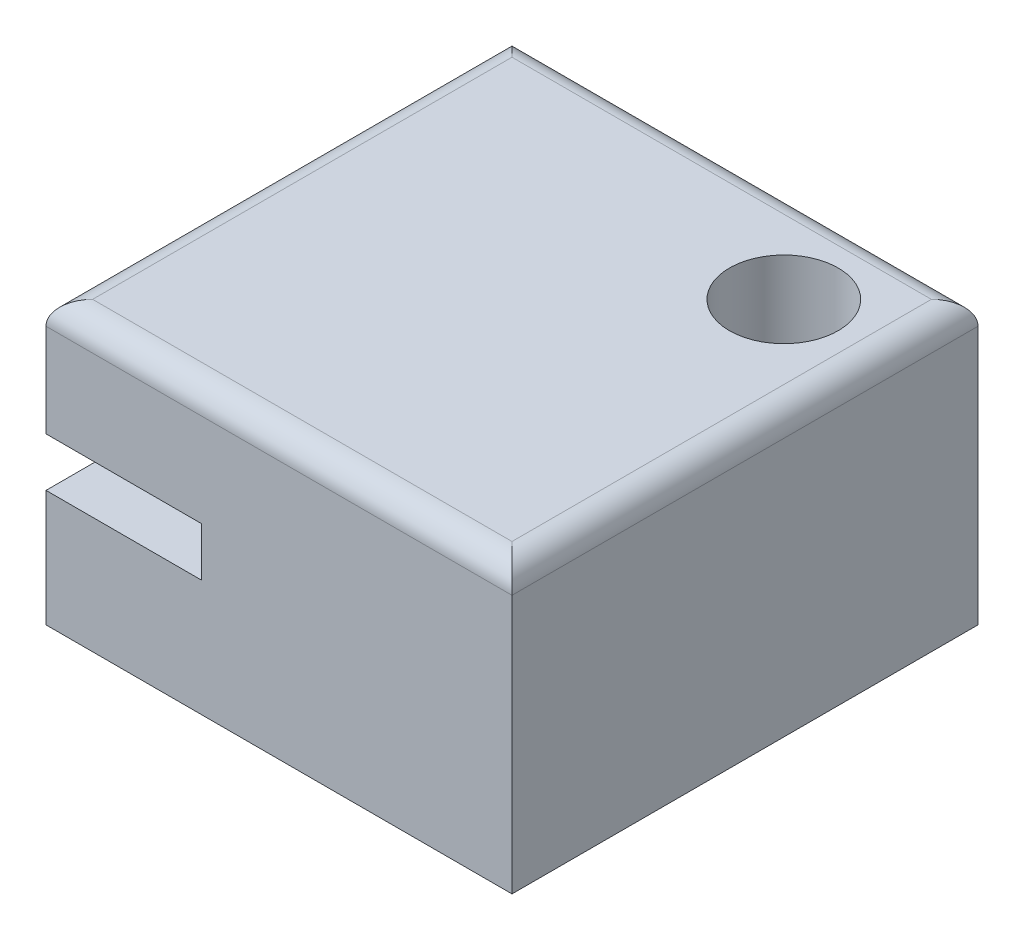
from build123d import *

# Parameters (mm, degrees)
SKETCH1_W           = 15.24
SKETCH1_H           = 15.24
BOSS_EXTRUDE1_DEPTH = 3.81
BOSS_EXTRUDE2_DEPTH = 1.6002
SKETCH3_W           = 15.24
SKETCH3_H           = 15.24
BOSS_EXTRUDE3_DEPTH = 3.81
SKETCH4_R           = 1.778
CUT_EXTRUDE1_DEPTH  = 15.851000211
FILLET1_R           = 0.762


with BuildPart() as part:
    # Sketch1 → Boss-Extrude1 (new body)
    with BuildSketch(Plane(origin=(0, 0, 0), x_dir=(1, 0, 0), z_dir=(0, 1, 0))):
        with Locations((-1.182029268, 0)):
            Rectangle(SKETCH1_W, SKETCH1_H)
    extrude(amount=BOSS_EXTRUDE1_DEPTH)

    # Sketch2 → Boss-Extrude2 (add)
    with BuildSketch(Plane(origin=(0, 3.81, 0), x_dir=(1, 0, 0), z_dir=(0, 1, 0))):
        Polygon((-8.802029268, -2.54), (-3.722029268, -2.54), (-3.722029268, -7.62), (6.437970732, -7.62), (6.437970732, 7.62), (-8.802029268, 7.62), align=None)
    extrude(amount=BOSS_EXTRUDE2_DEPTH)

    # Sketch3 → Boss-Extrude3 (add)
    with BuildSketch(Plane(origin=(0, 5.4102, 0), x_dir=(1, 0, 0), z_dir=(0, 1, 0))):
        with Locations((-1.182029268, 0)):
            Rectangle(SKETCH3_W, SKETCH3_H)
    extrude(amount=BOSS_EXTRUDE3_DEPTH)

    # Sketch4 → Cut-Extrude1 (cut, through all)
    with BuildSketch(Plane(origin=(0, 9.2202, 0), x_dir=(1, 0, 0), z_dir=(0, 1, 0))):
        with Locations(Location((3.262970732, 4.445, 0), (0, 0, 270))):
            Circle(SKETCH4_R)
    extrude(amount=-CUT_EXTRUDE1_DEPTH, mode=Mode.SUBTRACT)

    # Fillet1
    fillet1_edges = [part.edges().sort_by_distance(p)[0] for p in [
        (-8.802029268, 9.2202, 0),
        (-1.182029268, 9.2202, 7.62),
        (6.437970732, 9.2202, 0),
        (-1.182029268, 9.2202, -7.62),
    ]]
    fillet(fillet1_edges, radius=FILLET1_R)


solid = part.part
